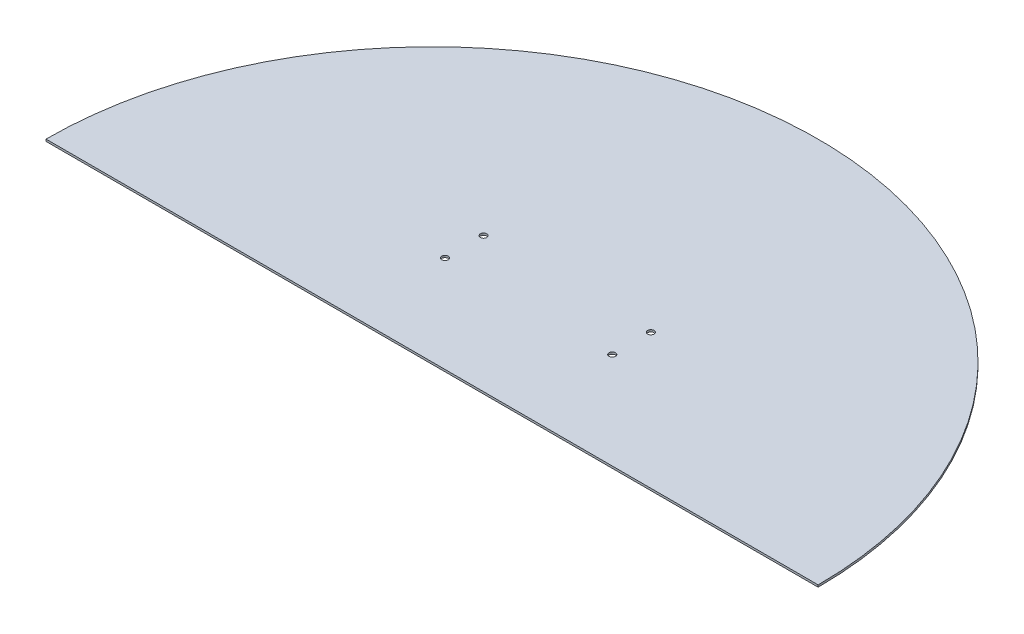
from build123d import *

# Parameters (mm, degrees)
BOSS_EXTRUDE1_DEPTH = 3.175
CUT_EXTRUDE1_REACH  = 850.534


with BuildPart() as part:
    # Sketch1 → Boss-Extrude1 (new body)
    with BuildSketch(Plane(origin=(0, 0, 0), x_dir=(1, 0, 0), z_dir=(0, 1, 0))):
        with BuildLine():
            Line((-600, 0), (600, 0))
            ThreePointArc((600, 0), (0, 600), (-600, 0))
        make_face()
    extrude(amount=BOSS_EXTRUDE1_DEPTH)

    # Sketch2 → Cut-Extrude1 (cut, up to next)
    with BuildSketch(Plane(origin=(0, 3.175, 0), x_dir=(1, 0, 0), z_dir=(0, 1, 0)), mode=Mode.PRIVATE) as cut_extrude1_sk1:
        with BuildLine():
            Line((-130, 205), (-130, 210))
            Line((-130, 210), (-125, 210))
            ThreePointArc((-125, 210), (-133.535533906, 213.535533906), (-130, 205))
        make_face()
    cut_extrude1_tool1 = extrude(cut_extrude1_sk1.sketch, amount=-CUT_EXTRUDE1_REACH, mode=Mode.PRIVATE) & part.part
    # Sketch2 → Cut-Extrude1 (cut, up to next)
    with BuildSketch(Plane(origin=(0, 3.175, 0), x_dir=(1, 0, 0), z_dir=(0, 1, 0)), mode=Mode.PRIVATE) as cut_extrude1_sk2:
        with BuildLine():
            Line((-125, 210), (-130, 210))
            Line((-130, 210), (-130, 205))
            ThreePointArc((-130, 205), (-126.464466094, 206.464466094), (-125, 210))
        make_face()
    cut_extrude1_tool2 = extrude(cut_extrude1_sk2.sketch, amount=-CUT_EXTRUDE1_REACH, mode=Mode.PRIVATE) & part.part
    # Sketch2 → Cut-Extrude1 (cut, up to next)
    with BuildSketch(Plane(origin=(0, 3.175, 0), x_dir=(1, 0, 0), z_dir=(0, 1, 0)), mode=Mode.PRIVATE) as cut_extrude1_sk3:
        with BuildLine():
            Line((-130, 205), (-130, 210))
            Line((-130, 210), (-125, 210))
            ThreePointArc((-125, 210), (-133.535533906, 213.535533906), (-130, 205))
        make_face()
    cut_extrude1_tool3 = extrude(cut_extrude1_sk3.sketch, amount=-CUT_EXTRUDE1_REACH, mode=Mode.PRIVATE) & part.part
    # Sketch2 → Cut-Extrude1 (cut, up to next)
    with BuildSketch(Plane(origin=(0, 3.175, 0), x_dir=(1, 0, 0), z_dir=(0, 1, 0)), mode=Mode.PRIVATE) as cut_extrude1_sk4:
        with BuildLine():
            Line((-125, 210), (-130, 210))
            Line((-130, 210), (-130, 205))
            ThreePointArc((-130, 205), (-126.464466094, 206.464466094), (-125, 210))
        make_face()
    cut_extrude1_tool4 = extrude(cut_extrude1_sk4.sketch, amount=-CUT_EXTRUDE1_REACH, mode=Mode.PRIVATE) & part.part
    # Sketch2 → Cut-Extrude1 (cut, up to next)
    with BuildSketch(Plane(origin=(0, 3.175, 0), x_dir=(1, 0, 0), z_dir=(0, 1, 0)), mode=Mode.PRIVATE) as cut_extrude1_sk5:
        with BuildLine():
            ThreePointArc((-125, 150), (-126.464466094, 153.535533906), (-130, 155))
            Line((-130, 155), (-130, 150))
            Line((-130, 150), (-125, 150))
        make_face()
    cut_extrude1_tool5 = extrude(cut_extrude1_sk5.sketch, amount=-CUT_EXTRUDE1_REACH, mode=Mode.PRIVATE) & part.part
    # Sketch2 → Cut-Extrude1 (cut, up to next)
    with BuildSketch(Plane(origin=(0, 3.175, 0), x_dir=(1, 0, 0), z_dir=(0, 1, 0)), mode=Mode.PRIVATE) as cut_extrude1_sk6:
        with BuildLine():
            Line((-130, 150), (-130, 155))
            ThreePointArc((-130, 155), (-133.535533906, 146.464466094), (-125, 150))
            Line((-125, 150), (-130, 150))
        make_face()
    cut_extrude1_tool6 = extrude(cut_extrude1_sk6.sketch, amount=-CUT_EXTRUDE1_REACH, mode=Mode.PRIVATE) & part.part
    # Sketch2 → Cut-Extrude1 (cut, up to next)
    with BuildSketch(Plane(origin=(0, 3.175, 0), x_dir=(1, 0, 0), z_dir=(0, 1, 0)), mode=Mode.PRIVATE) as cut_extrude1_sk7:
        with BuildLine():
            ThreePointArc((-125, 150), (-126.464466094, 153.535533906), (-130, 155))
            Line((-130, 155), (-130, 150))
            Line((-130, 150), (-125, 150))
        make_face()
    cut_extrude1_tool7 = extrude(cut_extrude1_sk7.sketch, amount=-CUT_EXTRUDE1_REACH, mode=Mode.PRIVATE) & part.part
    # Sketch2 → Cut-Extrude1 (cut, up to next)
    with BuildSketch(Plane(origin=(0, 3.175, 0), x_dir=(1, 0, 0), z_dir=(0, 1, 0)), mode=Mode.PRIVATE) as cut_extrude1_sk8:
        with BuildLine():
            Line((-130, 150), (-130, 155))
            ThreePointArc((-130, 155), (-133.535533906, 146.464466094), (-125, 150))
            Line((-125, 150), (-130, 150))
        make_face()
    cut_extrude1_tool8 = extrude(cut_extrude1_sk8.sketch, amount=-CUT_EXTRUDE1_REACH, mode=Mode.PRIVATE) & part.part
    # Sketch2 → Cut-Extrude1 (cut, up to next)
    with BuildSketch(Plane(origin=(0, 3.175, 0), x_dir=(1, 0, 0), z_dir=(0, 1, 0)), mode=Mode.PRIVATE) as cut_extrude1_sk9:
        with BuildLine():
            ThreePointArc((135, 150), (133.535533906, 153.535533906), (130, 155))
            Line((130, 155), (130, 150))
            Line((130, 150), (125, 150))
            ThreePointArc((125, 150), (130, 145), (135, 150))
        make_face()
    cut_extrude1_tool9 = extrude(cut_extrude1_sk9.sketch, amount=-CUT_EXTRUDE1_REACH, mode=Mode.PRIVATE) & part.part
    # Sketch2 → Cut-Extrude1 (cut, up to next)
    with BuildSketch(Plane(origin=(0, 3.175, 0), x_dir=(1, 0, 0), z_dir=(0, 1, 0)), mode=Mode.PRIVATE) as cut_extrude1_sk10:
        with BuildLine():
            Line((130, 150), (130, 155))
            ThreePointArc((130, 155), (126.464466094, 153.535533906), (125, 150))
            Line((125, 150), (130, 150))
        make_face()
    cut_extrude1_tool10 = extrude(cut_extrude1_sk10.sketch, amount=-CUT_EXTRUDE1_REACH, mode=Mode.PRIVATE) & part.part
    # Sketch2 → Cut-Extrude1 (cut, up to next)
    with BuildSketch(Plane(origin=(0, 3.175, 0), x_dir=(1, 0, 0), z_dir=(0, 1, 0)), mode=Mode.PRIVATE) as cut_extrude1_sk11:
        with BuildLine():
            ThreePointArc((135, 150), (133.535533906, 153.535533906), (130, 155))
            Line((130, 155), (130, 150))
            Line((130, 150), (125, 150))
            ThreePointArc((125, 150), (130, 145), (135, 150))
        make_face()
    cut_extrude1_tool11 = extrude(cut_extrude1_sk11.sketch, amount=-CUT_EXTRUDE1_REACH, mode=Mode.PRIVATE) & part.part
    # Sketch2 → Cut-Extrude1 (cut, up to next)
    with BuildSketch(Plane(origin=(0, 3.175, 0), x_dir=(1, 0, 0), z_dir=(0, 1, 0)), mode=Mode.PRIVATE) as cut_extrude1_sk12:
        with BuildLine():
            Line((130, 150), (130, 155))
            ThreePointArc((130, 155), (126.464466094, 153.535533906), (125, 150))
            Line((125, 150), (130, 150))
        make_face()
    cut_extrude1_tool12 = extrude(cut_extrude1_sk12.sketch, amount=-CUT_EXTRUDE1_REACH, mode=Mode.PRIVATE) & part.part
    # Sketch2 → Cut-Extrude1 (cut, up to next)
    with BuildSketch(Plane(origin=(0, 3.175, 0), x_dir=(1, 0, 0), z_dir=(0, 1, 0)), mode=Mode.PRIVATE) as cut_extrude1_sk13:
        with BuildLine():
            ThreePointArc((135, 210), (130, 215), (125, 210))
            Line((125, 210), (130, 210))
            Line((130, 210), (130, 205))
            ThreePointArc((130, 205), (133.535533906, 206.464466094), (135, 210))
        make_face()
    cut_extrude1_tool13 = extrude(cut_extrude1_sk13.sketch, amount=-CUT_EXTRUDE1_REACH, mode=Mode.PRIVATE) & part.part
    # Sketch2 → Cut-Extrude1 (cut, up to next)
    with BuildSketch(Plane(origin=(0, 3.175, 0), x_dir=(1, 0, 0), z_dir=(0, 1, 0)), mode=Mode.PRIVATE) as cut_extrude1_sk14:
        with BuildLine():
            Line((130, 210), (125, 210))
            ThreePointArc((125, 210), (126.464466094, 206.464466094), (130, 205))
            Line((130, 205), (130, 210))
        make_face()
    cut_extrude1_tool14 = extrude(cut_extrude1_sk14.sketch, amount=-CUT_EXTRUDE1_REACH, mode=Mode.PRIVATE) & part.part
    # Sketch2 → Cut-Extrude1 (cut, up to next)
    with BuildSketch(Plane(origin=(0, 3.175, 0), x_dir=(1, 0, 0), z_dir=(0, 1, 0)), mode=Mode.PRIVATE) as cut_extrude1_sk15:
        with BuildLine():
            ThreePointArc((135, 210), (130, 215), (125, 210))
            Line((125, 210), (130, 210))
            Line((130, 210), (130, 205))
            ThreePointArc((130, 205), (133.535533906, 206.464466094), (135, 210))
        make_face()
    cut_extrude1_tool15 = extrude(cut_extrude1_sk15.sketch, amount=-CUT_EXTRUDE1_REACH, mode=Mode.PRIVATE) & part.part
    # Sketch2 → Cut-Extrude1 (cut, up to next)
    with BuildSketch(Plane(origin=(0, 3.175, 0), x_dir=(1, 0, 0), z_dir=(0, 1, 0)), mode=Mode.PRIVATE) as cut_extrude1_sk16:
        with BuildLine():
            Line((130, 210), (125, 210))
            ThreePointArc((125, 210), (126.464466094, 206.464466094), (130, 205))
            Line((130, 205), (130, 210))
        make_face()
    cut_extrude1_tool16 = extrude(cut_extrude1_sk16.sketch, amount=-CUT_EXTRUDE1_REACH, mode=Mode.PRIVATE) & part.part
    add(cut_extrude1_tool1.solids().sort_by_distance((-130.707355, 3.175, -210.707355))[0], mode=Mode.SUBTRACT)
    add(cut_extrude1_tool2.solids().sort_by_distance((-127.877934, 3.175, -207.877934))[0], mode=Mode.SUBTRACT)
    add(cut_extrude1_tool3.solids().sort_by_distance((-130.707355, 3.175, -210.707355))[0], mode=Mode.SUBTRACT)
    add(cut_extrude1_tool4.solids().sort_by_distance((-127.877934, 3.175, -207.877934))[0], mode=Mode.SUBTRACT)
    add(cut_extrude1_tool5.solids().sort_by_distance((-127.877934, 3.175, -152.122066))[0], mode=Mode.SUBTRACT)
    add(cut_extrude1_tool6.solids().sort_by_distance((-130.707355, 3.175, -149.292645))[0], mode=Mode.SUBTRACT)
    add(cut_extrude1_tool7.solids().sort_by_distance((-127.877934, 3.175, -152.122066))[0], mode=Mode.SUBTRACT)
    add(cut_extrude1_tool8.solids().sort_by_distance((-130.707355, 3.175, -149.292645))[0], mode=Mode.SUBTRACT)
    add(cut_extrude1_tool9.solids().sort_by_distance((130.707355, 3.175, -149.292645))[0], mode=Mode.SUBTRACT)
    add(cut_extrude1_tool10.solids().sort_by_distance((127.877934, 3.175, -152.122066))[0], mode=Mode.SUBTRACT)
    add(cut_extrude1_tool11.solids().sort_by_distance((130.707355, 3.175, -149.292645))[0], mode=Mode.SUBTRACT)
    add(cut_extrude1_tool12.solids().sort_by_distance((127.877934, 3.175, -152.122066))[0], mode=Mode.SUBTRACT)
    add(cut_extrude1_tool13.solids().sort_by_distance((130.707355, 3.175, -210.707355))[0], mode=Mode.SUBTRACT)
    add(cut_extrude1_tool14.solids().sort_by_distance((127.877934, 3.175, -207.877934))[0], mode=Mode.SUBTRACT)
    add(cut_extrude1_tool15.solids().sort_by_distance((130.707355, 3.175, -210.707355))[0], mode=Mode.SUBTRACT)
    add(cut_extrude1_tool16.solids().sort_by_distance((127.877934, 3.175, -207.877934))[0], mode=Mode.SUBTRACT)


solid = part.part
